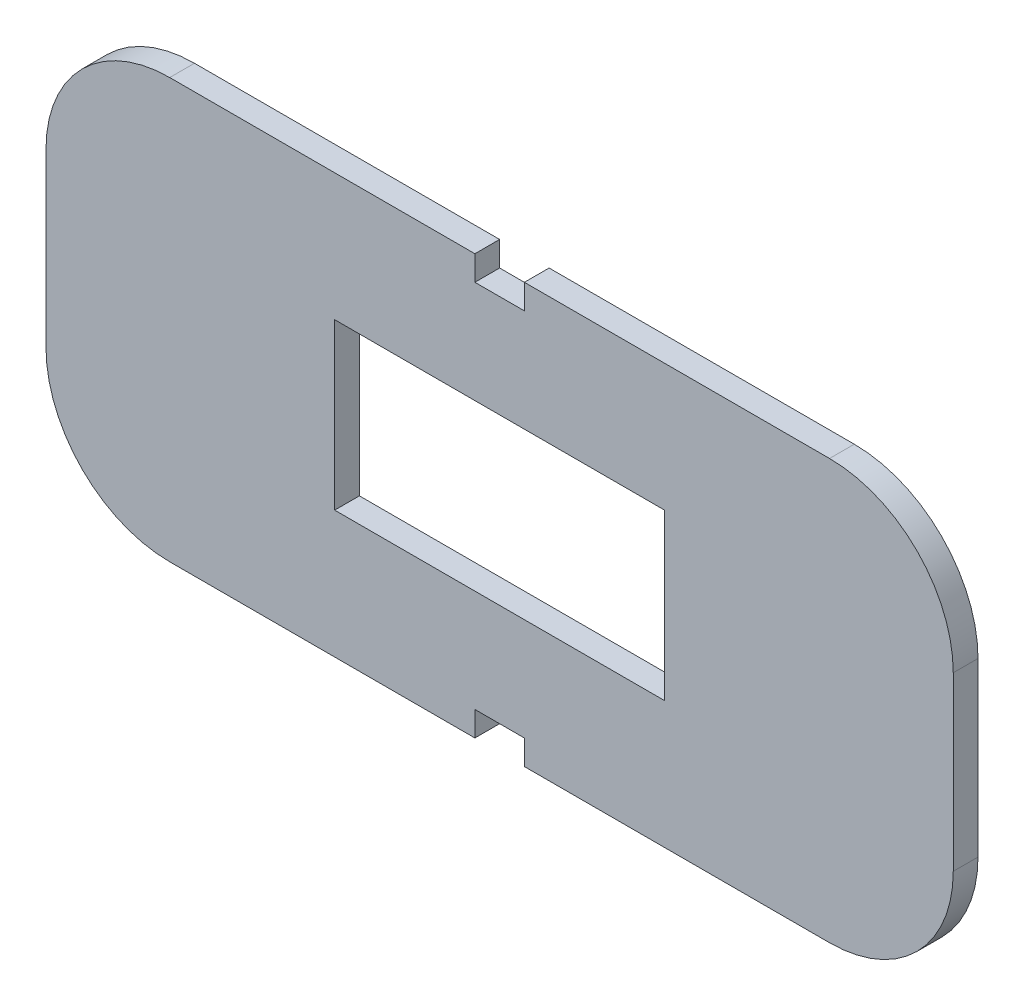
from build123d import *

# Parameters (mm, degrees)
SKETCH1_W           = 40
SKETCH1_H           = 20
BOSS_EXTRUDE1_DEPTH = 3
FILLET1_R           = 15


with BuildPart() as part:
    # Sketch1 → Boss-Extrude1 (new body)
    with BuildSketch(Plane.XY):
        Polygon((52, 50.85), (52, 47.85), (58, 47.85), (58, 50.85), (110, 50.85), (110, 0), (58, 0), (58, 3), (52, 3), (52, 0), (0, 0), (0, 50.85), align=None)
        with Locations((55, 25.425)):
            Rectangle(SKETCH1_W, SKETCH1_H, mode=Mode.SUBTRACT)
    extrude(amount=BOSS_EXTRUDE1_DEPTH)

    # Fillet1
    fillet1_edges = [part.edges().sort_by_distance(p)[0] for p in [
        (0, 0, 1.5),
        (110, 0, 1.5),
        (110, 50.85, 1.5),
        (0, 50.85, 1.5),
    ]]
    fillet(fillet1_edges, radius=FILLET1_R)


solid = part.part
